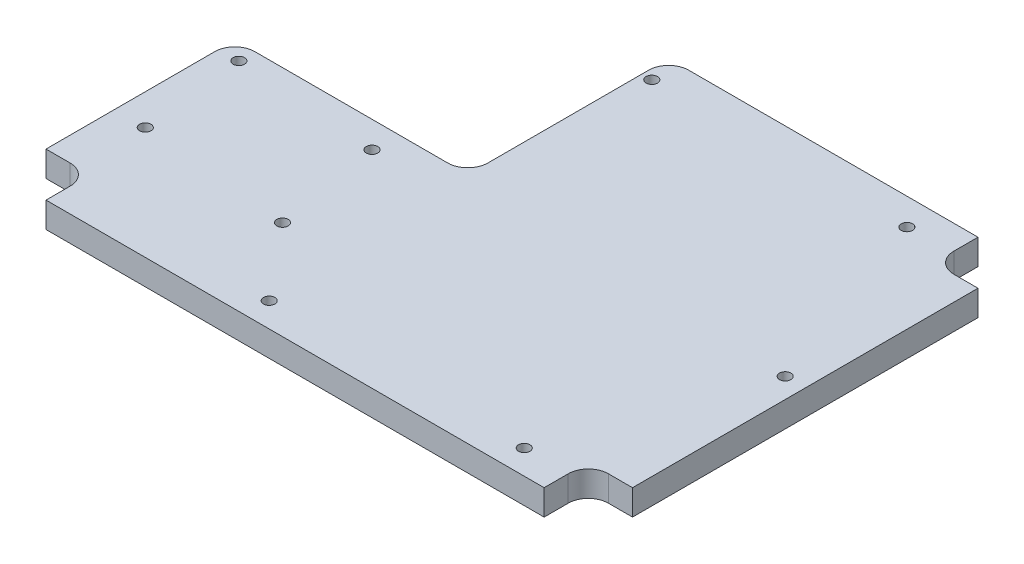
from build123d import *

# Parameters (mm, degrees)
SKETCH1_R           = 1.4224
BOSS_EXTRUDE1_DEPTH = 6.35


with BuildPart() as part:
    # Sketch1 → Boss-Extrude1 (new body)
    with BuildSketch(Plane(origin=(0, 0, 0), x_dir=(1, 0, 0), z_dir=(0, 1, 0))):
        with BuildLine():
            Line((-73, -1), (-73, -43))
            Line((-73, -43), (-67, -43))
            ThreePointArc((-67, -43), (-63.464466094, -44.464466094), (-62, -48))
            Line((-62, -48), (-62, -54))
            Line((-62, -54), (62, -54))
            Line((62, -54), (62, -48))
            ThreePointArc((62, -48), (63.464466094, -44.464466094), (67, -43))
            Line((67, -43), (73, -43))
            Line((73, -43), (73, 43))
            Line((73, 43), (67, 43))
            ThreePointArc((67, 43), (63.464466094, 44.464466094), (62, 48))
            Line((62, 48), (62, 54))
            Line((62, 54), (-10, 54))
            ThreePointArc((-10, 54), (-13.535533906, 52.535533906), (-15, 49))
            Line((-15, 49), (-15, 9))
            ThreePointArc((-15, 9), (-16.464466094, 5.464466094), (-20, 4))
            Line((-20, 4), (-68, 4))
            ThreePointArc((-68, 4), (-71.535533906, 2.535533906), (-73, -1))
        make_face()
        with Locations(Location((68, 0, 0), (0, 0, 270))):
            Circle(SKETCH1_R, mode=Mode.SUBTRACT)
        with Locations(Location((-68, 0, 0), (0, 0, 270))):
            Circle(SKETCH1_R, mode=Mode.SUBTRACT)
        with Locations(Location((-27.69442531, -29.429, 0), (0, 0, 270))):
            Circle(SKETCH1_R, mode=Mode.SUBTRACT)
        with Locations(Location((-65.28642531, -26, 0), (0, 0, 270))):
            Circle(SKETCH1_R, mode=Mode.SUBTRACT)
        with Locations(Location((-32.26642531, -2.5812, 0), (0, 0, 270))):
            Circle(SKETCH1_R, mode=Mode.SUBTRACT)
        with Locations(Location((-12.52642531, -47.924899665, 0), (0, 0, 90))):
            Circle(SKETCH1_R, mode=Mode.SUBTRACT)
        with Locations(Location((50.975, -47.924899665, 0), (0, 0, 90))):
            Circle(SKETCH1_R, mode=Mode.SUBTRACT)
        with Locations(Location((-12.52642531, 47.325, 0), (0, 0, 90))):
            Circle(SKETCH1_R, mode=Mode.SUBTRACT)
        with Locations(Location((50.975, 47.325, 0), (0, 0, 90))):
            Circle(SKETCH1_R, mode=Mode.SUBTRACT)
    extrude(amount=BOSS_EXTRUDE1_DEPTH)


solid = part.part
